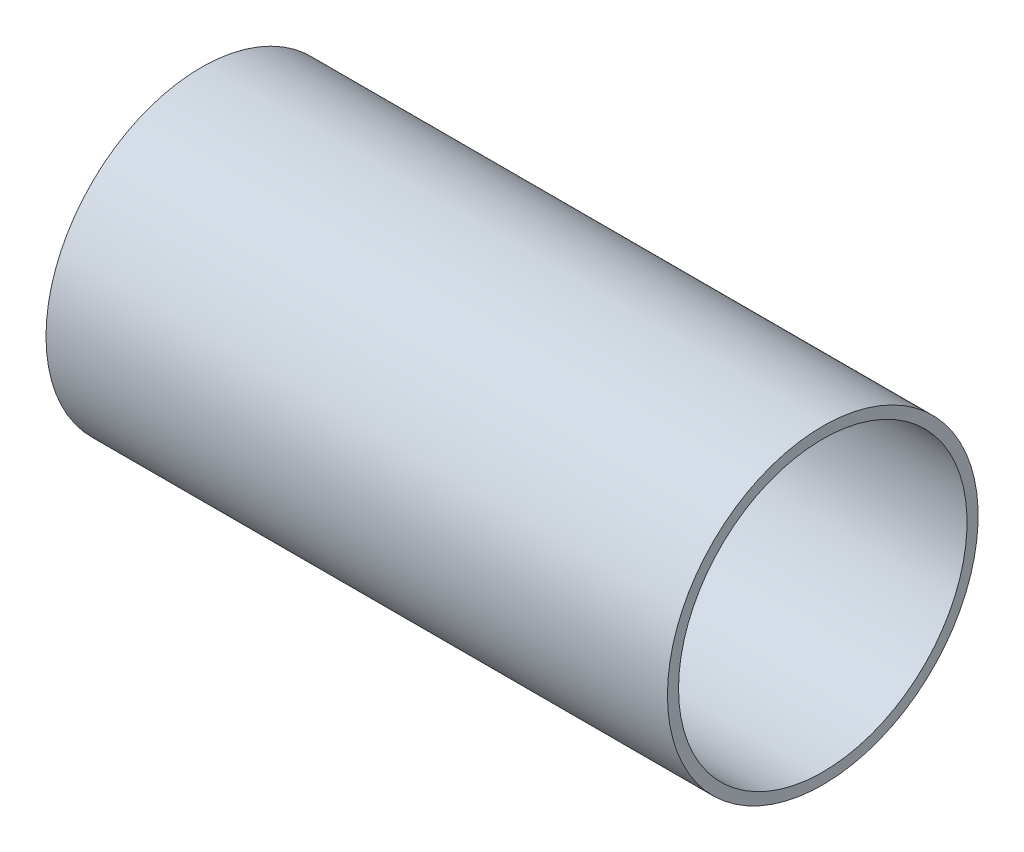
from build123d import *

# Parameters (mm, degrees)
ESQUISSE1_W = 28
ESQUISSE1_H = 0.5


with BuildPart() as part:
    # Esquisse1 → Révolution1 (revolve)
    with BuildSketch(Plane.XY, mode=Mode.PRIVATE) as r_volution1_sk:
        with Locations((-14.436151603, 6.75)):
            Rectangle(ESQUISSE1_W, ESQUISSE1_H)
    revolve(r_volution1_sk.sketch.rotate(Axis((-77.93611921, 0, 0), (1, 0, 0)), 90), axis=Axis((-77.93611921, 0, 0), (1, 0, 0)))


solid = part.part
